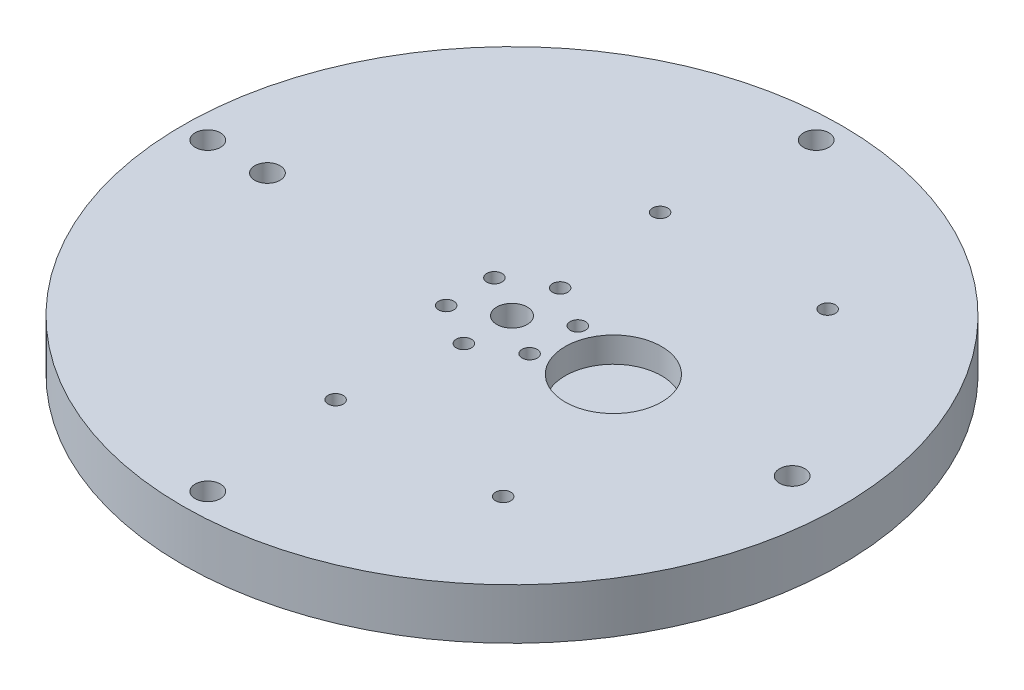
from build123d import *

# Parameters (mm, degrees)
SKETCH1_R           = 65
SKETCH1_R_2         = 3
SKETCH1_R_3         = 1.5
SKETCH1_R_4         = 2.5
SKETCH1_R_5         = 9.5
BOSS_EXTRUDE1_DEPTH = 10
SKETCH1_3_R         = 9.5
BOSS_EXTRUDE2_DEPTH = 5
SKETCH2_R           = 5
CUT_EXTRUDE1_DEPTH  = 5
SKETCH3_R           = 2.5
CUT_EXTRUDE2_DEPTH  = 10
SKETCH4_R           = 5
CUT_EXTRUDE3_DEPTH  = 5


with BuildPart() as part:
    # Sketch1 → Boss-Extrude1 (new body)
    with BuildSketch(Plane(origin=(0, 0, 0), x_dir=(1, 0, 0), z_dir=(0, 1, 0))):
        with Locations(Location((0, 0, 0), (0, 0, 270))):
            Circle(SKETCH1_R)
        with Locations(Location((0, 0, 0), (0, 0, 270))):
            Circle(SKETCH1_R_2, mode=Mode.SUBTRACT)
        with Locations(Location((0, 9.5, 0), (0, 0, 270))):
            Circle(SKETCH1_R_3, mode=Mode.SUBTRACT)
        with Locations(Location((8.227241336, 4.75, 0), (0, 0, 270))):
            Circle(SKETCH1_R_3, mode=Mode.SUBTRACT)
        with Locations(Location((8.227241336, -4.75, 0), (0, 0, 270))):
            Circle(SKETCH1_R_3, mode=Mode.SUBTRACT)
        with Locations(Location((0, -9.5, 0), (0, 0, 270))):
            Circle(SKETCH1_R_3, mode=Mode.SUBTRACT)
        with Locations(Location((-8.227241336, -4.75, 0), (0, 0, 270))):
            Circle(SKETCH1_R_3, mode=Mode.SUBTRACT)
        with Locations(Location((-8.227241336, 4.75, 0), (0, 0, 270))):
            Circle(SKETCH1_R_3, mode=Mode.SUBTRACT)
        with Locations(Location((0, -60, 0), (0, 0, 270))):
            Circle(SKETCH1_R_4, mode=Mode.SUBTRACT)
        with Locations(Location((-60, 0, 0), (0, 0, 270))):
            Circle(SKETCH1_R_4, mode=Mode.SUBTRACT)
        with Locations(Location((0, 60, 0), (0, 0, 270))):
            Circle(SKETCH1_R_4, mode=Mode.SUBTRACT)
        with Locations(Location((20, 0, 0), (0, 0, 270))):
            Circle(SKETCH1_R_5, mode=Mode.SUBTRACT)
        with Locations(Location((-3.048738704, 32.260845552, 0), (0, 0, 270))):
            Circle(SKETCH1_R_3, mode=Mode.SUBTRACT)
        with Locations(Location((30.001268663, 32.260845552, 0), (0, 0, 270))):
            Circle(SKETCH1_R_3, mode=Mode.SUBTRACT)
        with Locations(Location((55.001268663, 0.260845552, 0), (0, 0, 270))):
            Circle(SKETCH1_R_4, mode=Mode.SUBTRACT)
        with Locations(Location((30.001268663, -31.739154448, 0), (0, 0, 270))):
            Circle(SKETCH1_R_3, mode=Mode.SUBTRACT)
        with Locations(Location((-3.048738704, -31.739154448, 0), (0, 0, 270))):
            Circle(SKETCH1_R_3, mode=Mode.SUBTRACT)
    extrude(amount=BOSS_EXTRUDE1_DEPTH)

    # Sketch1<3> → Boss-Extrude2 (add)
    with BuildSketch(Plane(origin=(0, 0, 0), x_dir=(1, 0, 0), z_dir=(0, 1, 0))):
        with Locations(Location((20, 0, 0), (0, 0, 270))):
            Circle(SKETCH1_3_R)
    extrude(amount=BOSS_EXTRUDE2_DEPTH)

    # Sketch2 → Cut-Extrude1 (cut)
    with BuildSketch(Plane.XZ):
        with Locations(Location((30.001268663, 31.739154448, 0), (0, 0, 270))):
            Circle(SKETCH2_R)
        with Locations(Location((-3.048738704, 31.739154448, 0), (0, 0, 270))):
            Circle(SKETCH2_R)
        with Locations(Location((55.001268663, -0.260845552, 0), (0, 0, 270))):
            Circle(SKETCH2_R)
        with Locations(Location((30.001268663, -32.260845552, 0), (0, 0, 270))):
            Circle(SKETCH2_R)
        with Locations(Location((-3.048738704, -32.260845552, 0), (0, 0, 270))):
            Circle(SKETCH2_R)
    extrude(amount=-CUT_EXTRUDE1_DEPTH, mode=Mode.SUBTRACT)

    # Sketch3 → Cut-Extrude2 (cut)
    with BuildSketch(Plane(origin=(0, 10, 0), x_dir=(1, 0, 0), z_dir=(0, 1, 0))):
        with Locations(Location((-48.498731337, 0.260845552, 0), (0, 0, 270))):
            Circle(SKETCH3_R)
    extrude(amount=-CUT_EXTRUDE2_DEPTH, mode=Mode.SUBTRACT)

    # Sketch4 → Cut-Extrude3 (cut)
    with BuildSketch(Plane.XZ):
        with Locations(Location((-48.498731337, -0.260845552, 0), (0, 0, 270))):
            Circle(SKETCH4_R)
    extrude(amount=-CUT_EXTRUDE3_DEPTH, mode=Mode.SUBTRACT)


solid = part.part
